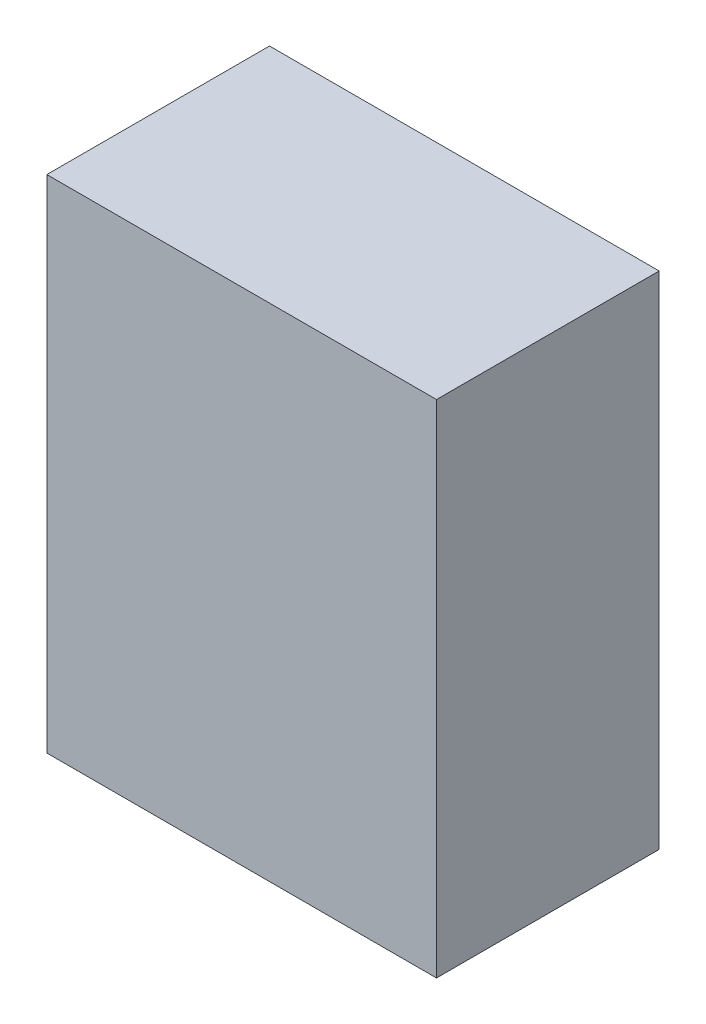
from build123d import *

# Parameters (mm, degrees)
SKETCH1_W           = 70
SKETCH1_H           = 90
BOSS_EXTRUDE1_DEPTH = 40


with BuildPart() as part:
    # Sketch1 → Boss-Extrude1 (new body)
    with BuildSketch(Plane.XY):
        Rectangle(SKETCH1_W, SKETCH1_H)
    extrude(amount=BOSS_EXTRUDE1_DEPTH)


solid = part.part
